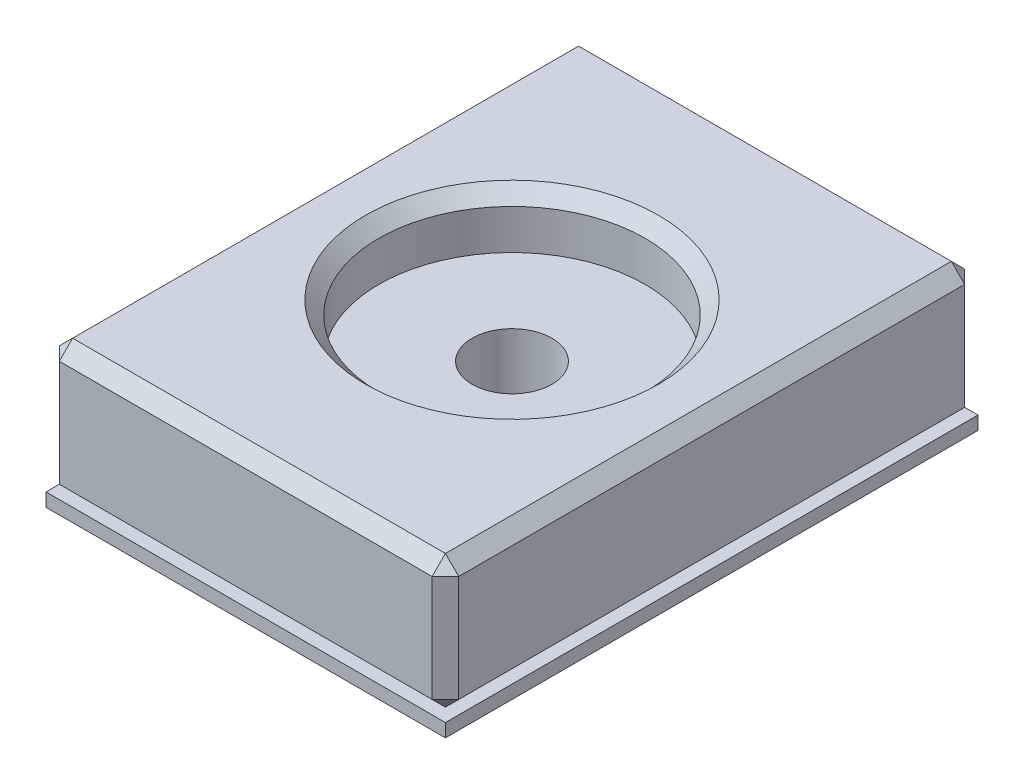
from build123d import *

# Parameters (mm, degrees)
CROQUIS1_W              = 15
CROQUIS1_H              = 5
SALIENTE_EXTRUIR1_DEPTH = 10
CROQUIS2_R              = 1.5
CORTAR_EXTRUIR1_DEPTH   = 14.462912018
CROQUIS7_R              = 5
CORTAR_EXTRUIR3_DEPTH   = 2
CROQUIS3_R              = 4
SALIENTE_EXTRUIR2_DEPTH = 3
CROQUIS4_R              = 4
SALIENTE_EXTRUIR3_DEPTH = 6
SALIENTE_EXTRUIR3_TAPER = 33
SALIENTE_EXTRUIR4_REACH = 19.328
CROQUIS5_R              = 0.103554441
CROQUIS6_R              = 2
CORTAR_EXTRUIR2_DEPTH   = 2
CROQUIS9_W              = 15
CROQUIS9_H              = 20
CROQUIS9_R              = 1.5
SALIENTE_EXTRUIR5_DEPTH = 0.5
CHAFL_N1_SIZE           = 0.5


with BuildPart() as part:
    # Croquis1 → Saliente-Extruir1 (new, symmetric)
    with BuildSketch(Plane.XY):
        Rectangle(CROQUIS1_W, CROQUIS1_H)
    extrude(amount=SALIENTE_EXTRUIR1_DEPTH, both=True)

    # Croquis2 → Cortar-Extruir1 (cut, through all)
    with BuildSketch(Plane(origin=(0, 2.5, 0), x_dir=(1, 0, 0), z_dir=(0, 1, 0))):
        with Locations(Location((0, 0, 0), (0, 0, 270))):
            Circle(CROQUIS2_R)
    extrude(amount=-CORTAR_EXTRUIR1_DEPTH, mode=Mode.SUBTRACT)

    # Croquis7 → Cortar-Extruir3 (cut)
    with BuildSketch(Plane(origin=(0, 2.5, 0), x_dir=(1, 0, 0), z_dir=(0, 1, 0))):
        with Locations(Location((0, 0, 0), (0, 0, 270))):
            Circle(CROQUIS7_R)
    extrude(amount=-CORTAR_EXTRUIR3_DEPTH, mode=Mode.SUBTRACT)

    # Chaflán1
    chafl_n1_edges = [part.edges().sort_by_distance(p)[0] for p in [
        (-7.5, 0, 10),
        (0, -2.5, 10),
        (0, 2.5, -5),
        (7.5, 0, 10),
        (0, -2.5, -10),
        (-7.5, 0, -10),
        (0, 2.5, -10),
        (7.5, 0, -10),
        (0, 2.5, 10),
        (7.5, -2.5, 0),
        (-7.5, -2.5, 0),
        (-7.5, 2.5, 0),
        (7.5, 2.5, 0),
    ]]
    chamfer(chafl_n1_edges, length=CHAFL_N1_SIZE)


with BuildPart() as body_2:
    # Croquis3 → Saliente-Extruir2 (new body)
    with BuildSketch(Plane(origin=(0, 0.5, 0), x_dir=(1, 0, 0), z_dir=(0, 1, 0))):
        with Locations(Location((0, 0, 0), (0, 0, 270))):
            Circle(CROQUIS3_R)
        Polygon((-1.732050808, -3), (1.732050808, -3), (3.464101615, 0), (1.732050808, 3), (-1.732050808, 3), (-3.464101615, 0), align=None, mode=Mode.SUBTRACT)
    extrude(amount=SALIENTE_EXTRUIR2_DEPTH)

    # Croquis4 → Saliente-Extruir3 (add)
    with BuildSketch(Plane(origin=(0, 3.5, 0), x_dir=(1, 0, 0), z_dir=(0, 1, 0))):
        with Locations(Location((0, 0, 0), (0, 0, 270))):
            Circle(CROQUIS4_R)
    extrude(amount=SALIENTE_EXTRUIR3_DEPTH, taper=SALIENTE_EXTRUIR3_TAPER)

    # Saliente-Extruir4: up to this cone (the profile starts outside it)
    saliente_extruir4_end = Plane(origin=(0, 9.5, 0), z_dir=(0, -1, 0)).offset(-0.159458855) * Cone(1e-06, 13.047257239, 20.091013296, align=(Align.CENTER, Align.CENTER, Align.MIN), mode=Mode.PRIVATE)
    # Croquis5 → Saliente-Extruir4 (add, up to the surface)
    with BuildSketch(Plane(origin=(0, 9.5, 0), x_dir=(1, 0, 0), z_dir=(0, 1, 0)), mode=Mode.PRIVATE) as saliente_extruir4_sk1:
        with BuildLine():
            Line((-1.648700226, 2.200974231), (-0.805838424, 1.553423456))
            Line((-0.805838424, 1.553423456), (-0.849796735, 2.61540542))
            ThreePointArc((-0.849796735, 2.61540542), (-0.731113465, 2.651032459), (-0.610945733, 2.681276806))
            Line((-0.610945733, 2.681276806), (-0.10433579, 1.746886958))
            Line((-0.10433579, 1.746886958), (0.287453274, 2.734935212))
            ThreePointArc((0.287453274, 2.734935212), (0.410366658, 2.719209298), (0.532446828, 2.697962263))
            Line((0.532446828, 2.697962263), (0.61520745, 1.638297834))
            Line((0.61520745, 1.638297834), (1.375, 2.38156986))
            ThreePointArc((1.375, 2.38156986), (1.480890658, 2.317210146), (1.583774496, 2.248145535))
            Line((1.583774496, 2.248145535), (1.228375733, 1.246432131))
            Line((1.228375733, 1.246432131), (2.224796735, 1.616409444))
            ThreePointArc((2.224796735, 1.616409444), (2.29535521, 1.514544308), (2.361253164, 1.40960402))
            Line((2.361253164, 1.40960402), (1.629146692, 0.63904699))
            Line((1.629146692, 0.63904699), (2.689905902, 0.57175715))
            ThreePointArc((2.689905902, 0.57175715), (2.712931993, 0.45), (2.73044971, 0.327329164))
            Line((2.73044971, 0.327329164), (1.748223388, -0.078835182))
            Line((1.748223388, -0.078835182), (2.689905902, -0.57175715))
            ThreePointArc((2.689905902, -0.57175715), (2.661418189, -0.692353396), (2.627526695, -0.811543878))
            Line((2.627526695, -0.811543878), (1.565016378, -0.783086035))
            Line((1.565016378, -0.783086035), (2.224796735, -1.616409444))
            ThreePointArc((2.224796735, -1.616409444), (2.149721001, -1.7149926), (2.070280445, -1.810093611))
            Line((2.070280445, -1.810093611), (1.111203818, -1.351934198))
            Line((1.111203818, -1.351934198), (1.375, -2.38156986))
            ThreePointArc((1.375, -2.38156986), (1.266317523, -2.441094003), (1.155063897, -2.495661715))
            Line((1.155063897, -2.495661715), (0.465254023, -1.687020656))
            Line((0.465254023, -1.687020656), (0.287453274, -2.734935212))
            ThreePointArc((0.287453274, -2.734935212), (0.163956241, -2.745108076), (0.040126308, -2.749707235))
            Line((0.040126308, -2.749707235), (-0.261142419, -1.730405917))
            Line((-0.261142419, -1.730405917), (-0.849796735, -2.61540542))
            ThreePointArc((-0.849796735, -2.61540542), (-0.966754565, -2.574468025), (-1.081749483, -2.528303395))
            Line((-1.081749483, -2.528303395), (-0.942384964, -1.474588274))
            Line((-0.942384964, -1.474588274), (-1.840109167, -2.04364827))
            ThreePointArc((-1.840109167, -2.04364827), (-1.930304724, -1.958679064), (-2.016580962, -1.869732928))
            Line((-2.016580962, -1.869732928), (-1.460680588, -0.963800923))
            Line((-1.460680588, -0.963800923), (-2.512250009, -1.118525768))
            ThreePointArc((-2.512250009, -1.118525768), (-2.560087659, -1.004216698), (-2.602727273, -0.887868652))
            Line((-2.602727273, -0.887868652), (-1.726411268, -0.286363636))
            Line((-1.726411268, -0.286363636), (-2.75, 0))
            ThreePointArc((-2.75, 0), (-2.747208181, 0.123883857), (-2.738838393, 0.247516179))
            Line((-2.738838393, 0.247516179), (-1.693629756, 0.440588525))
            Line((-1.693629756, 0.440588525), (-2.512250009, 1.118525768))
            ThreePointArc((-2.512250009, 1.118525768), (-2.459311451, 1.230563769), (-2.401379473, 1.340103215))
            Line((-2.401379473, 1.340103215), (-1.368004273, 1.091358927))
            Line((-1.368004273, 1.091358927), (-1.840109167, 2.04364827))
            ThreePointArc((-1.840109167, 2.04364827), (-1.746177428, 2.124468025), (-1.648700226, 2.200974231))
        make_face()
        Circle(CROQUIS5_R, mode=Mode.SUBTRACT)
    saliente_extruir4_tool1 = extrude(saliente_extruir4_sk1.sketch, amount=-SALIENTE_EXTRUIR4_REACH, mode=Mode.PRIVATE) - saliente_extruir4_end
    add(saliente_extruir4_tool1.solids().sort_by_distance((-1.902837, 9.5, -1.140349))[0])

    # Croquis6 → Cortar-Extruir2 (cut)
    with BuildSketch(Plane.XZ.offset(-3.5)):
        with Locations(Location((0, 0, 0), (0, 0, 270))):
            Circle(CROQUIS6_R)
    extrude(amount=-CORTAR_EXTRUIR2_DEPTH, mode=Mode.SUBTRACT)


with BuildPart() as body_2_2:
    # Croquis9 → Saliente-Extruir5 (new body)
    with BuildSketch(Plane.XZ.offset(2.5)):
        Rectangle(CROQUIS9_W, CROQUIS9_H)
        with Locations(Location((0, 0, 0), (0, 0, 270))):
            Circle(CROQUIS9_R, mode=Mode.SUBTRACT)
    extrude(amount=SALIENTE_EXTRUIR5_DEPTH)


solid = Compound([part.part, body_2_2.part])
